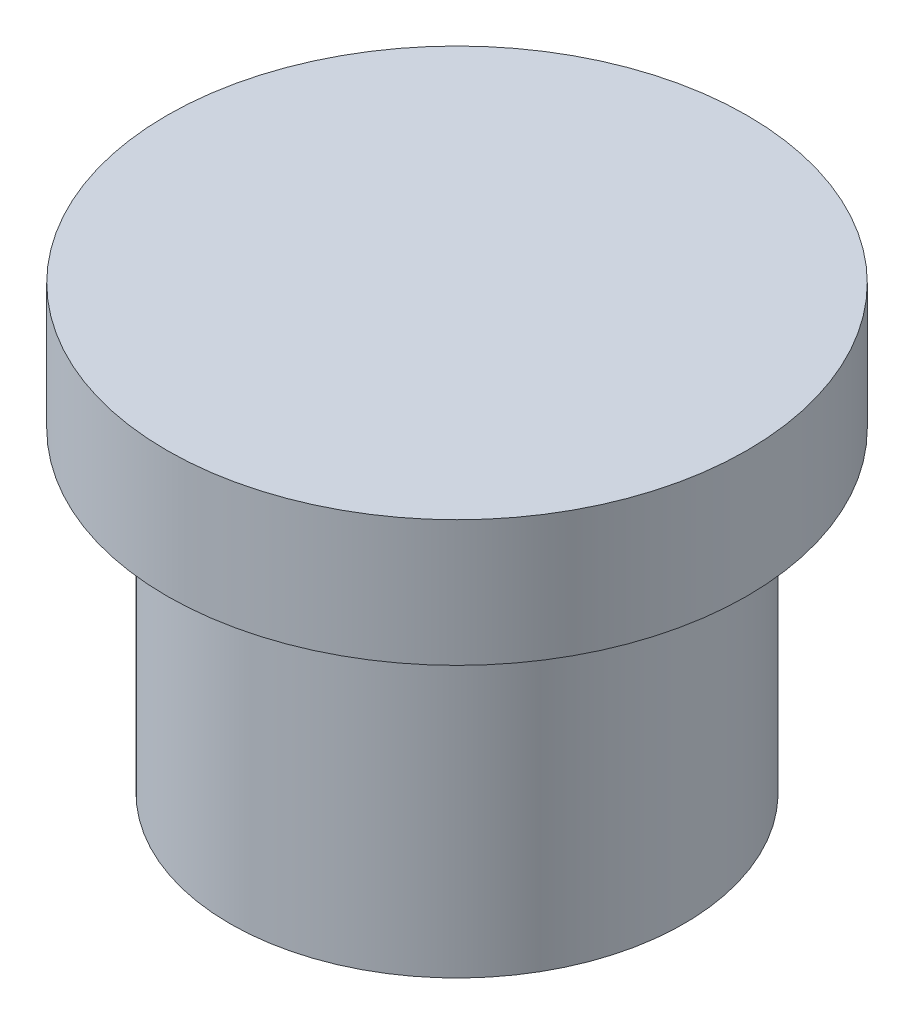
from build123d import *

# Parameters (mm, degrees)
CUT_EXTRUDE1_DEPTH      = 56.524769248
CUT_EXTRUDE1_DEPTH_BACK = 56.524769248
SKETCH2_W               = 36
SKETCH2_H               = 15


with BuildPart() as part:
    # Sketch1 → Revolve1 (revolve)
    with BuildSketch(Plane.XY, mode=Mode.PRIVATE) as revolve1_sk:
        with BuildLine():
            Line((8.808297686, 15.060389461), (8.244359234, 13.670434993))
            Line((8.244359234, 13.670434993), (16.137360004, -5))
            Line((16.137360004, -5), (18, -5))
            Line((18, -5), (18, 35))
            Line((18, 35), (23, 35))
            Line((23, 35), (23, 45))
            Line((23, 45), (18, 45))
            Line((18, 45), (0, 45))
            Line((0, 45), (0, 35.967908311))
            Line((0, 35.967908311), (8.808297686, 35.967908311))
            Line((8.808297686, 35.967908311), (8.808297686, 25.967908311))
            ThreePointArc((8.808297686, 25.967908311), (10.36, 20.514148886), (8.808297686, 15.060389461))
        make_face()
    revolve(revolve1_sk.sketch.rotate(Axis((0, 0, 0), (0, 1, 0)), 90), axis=Axis((0, 0, 0), (0, 1, 0)))

    # Sketch2 → Cut-Extrude1 (cut, two sides: drawn at the far end of the back side and taken through both)
    with BuildSketch(Plane(origin=(0, 0, 0), x_dir=(0, 0, -1), z_dir=(1, 0, 0)).offset(-CUT_EXTRUDE1_DEPTH_BACK)):
        with Locations((0, 2.5)):
            Rectangle(SKETCH2_W, SKETCH2_H)
    extrude(amount=CUT_EXTRUDE1_DEPTH + CUT_EXTRUDE1_DEPTH_BACK, mode=Mode.SUBTRACT)


solid = part.part
